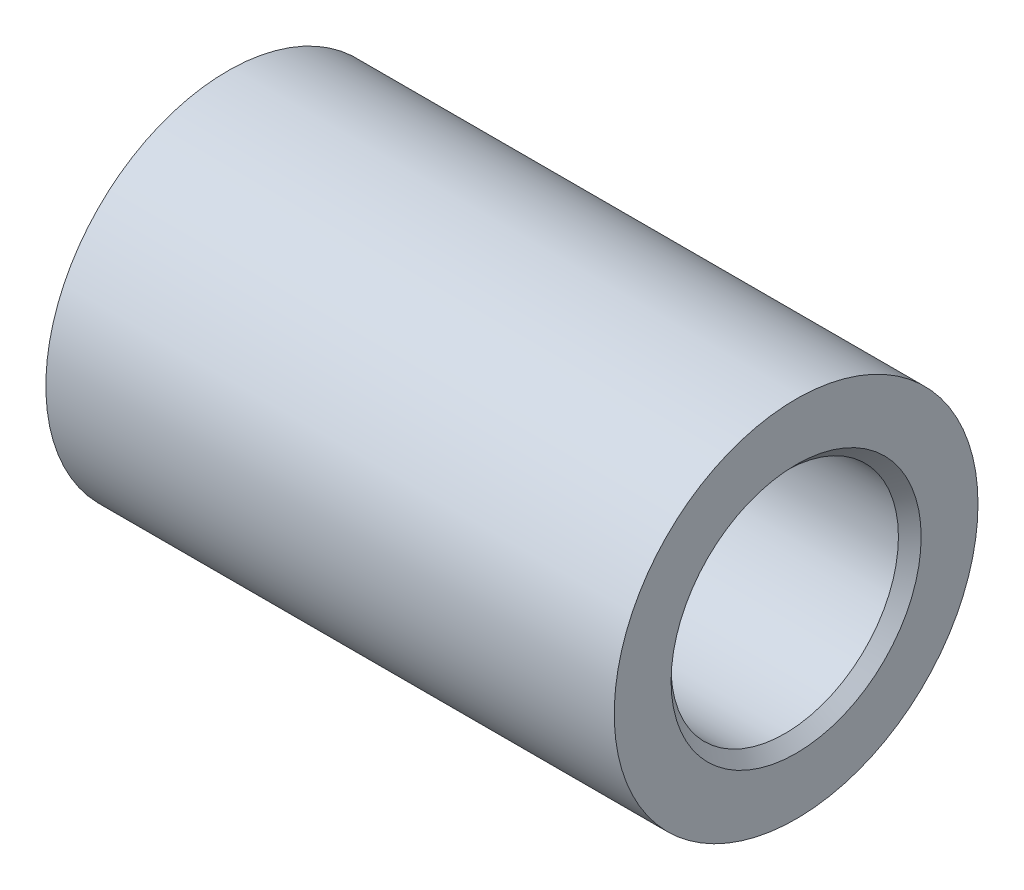
from build123d import *


with BuildPart() as part:
    # Sketch1 → Revolve1 (revolve)
    with BuildSketch(Plane.XY, mode=Mode.PRIVATE) as revolve1_sk:
        Polygon((2.575905915, 1.420384487), (-2.424094085, 1.420384487), (-2.424094085, 0.920384487), (-2.324094085, 0.820384487), (2.475905915, 0.820384487), (2.575905915, 0.920384487), align=None)
    revolve(revolve1_sk.sketch.rotate(Axis((-2.5, -0.179615513, 0), (1, 0, 0)), 270), axis=Axis((-2.5, -0.179615513, 0), (1, 0, 0)))


solid = part.part
